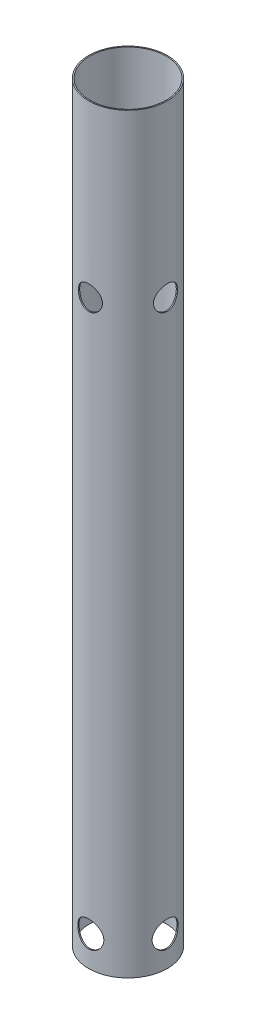
from build123d import *

# Parameters (mm, degrees)
SKETCH2_R           = 39.3
SKETCH2_R_2         = 38.15
BOSS_EXTRUDE1_DEPTH = 750
SKETCH3_R           = 13
SKETCH3_R_2         = 12
CUT_EXTRUDE1_DEPTH  = 753.056500537
CIRPATTERN1_COUNT   = 4


with BuildPart() as part:
    # Sketch2 → Boss-Extrude1 (new body)
    with BuildSketch(Plane(origin=(0, 0, 0), x_dir=(1, 0, 0), z_dir=(0, 1, 0))):
        with Locations(Location((0, 0, 0), (0, 0, 270))):
            Circle(SKETCH2_R)
        with Locations(Location((0, 0, 0), (0, 0, 270))):
            Circle(SKETCH2_R_2, mode=Mode.SUBTRACT)
    extrude(amount=BOSS_EXTRUDE1_DEPTH)

    # Sketch3 → Cut-Extrude1 (cut, through all)
    with BuildSketch(Plane.XY):
        with Locations(Location((0, 30, 0), (0, 0, 90))):
            Circle(SKETCH3_R)
        with Locations(Location((0, 580, 0), (0, 0, 90))):
            Circle(SKETCH3_R_2)
    cut_extrude1 = extrude(amount=-CUT_EXTRUDE1_DEPTH, mode=Mode.SUBTRACT)

    # CirPattern1: Cut-Extrude1 ×4 about axis
    cirpattern1_axis = Axis((0, 750, 0), (0, -1, 0))
    for i in range(1, CIRPATTERN1_COUNT):
        add(cut_extrude1.rotate(cirpattern1_axis, i * 360 / CIRPATTERN1_COUNT), mode=Mode.SUBTRACT)


solid = part.part
